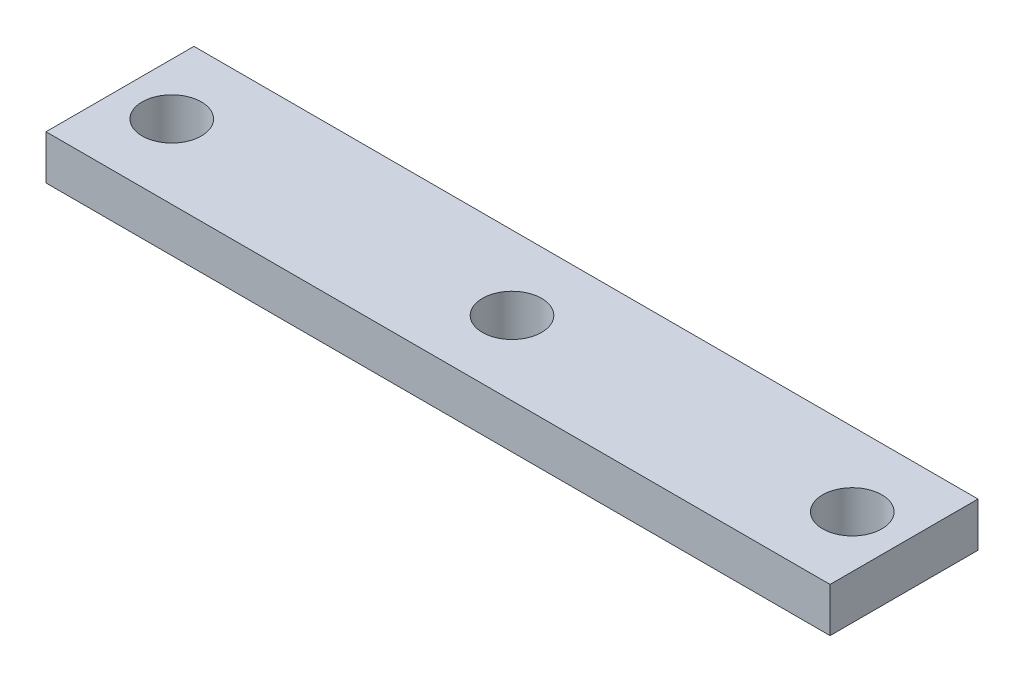
from build123d import *

# Parameters (mm, degrees)
SKETCH1_W           = 53
SKETCH1_H           = 10
SKETCH1_R           = 2
BOSS_EXTRUDE1_DEPTH = 3


with BuildPart() as part:
    # Sketch1 → Boss-Extrude1 (new body)
    with BuildSketch(Plane(origin=(0, 0, 0), x_dir=(1, 0, 0), z_dir=(0, 1, 0))):
        Rectangle(SKETCH1_W, SKETCH1_H)
        with Locations(Location((-23, 0, 0), (0, 0, 270))):
            Circle(SKETCH1_R, mode=Mode.SUBTRACT)
        with Locations(Location((23, 0, 0), (0, 0, 270))):
            Circle(SKETCH1_R, mode=Mode.SUBTRACT)
        with Locations(Location((0, 0, 0), (0, 0, 270))):
            Circle(SKETCH1_R, mode=Mode.SUBTRACT)
    extrude(amount=BOSS_EXTRUDE1_DEPTH)


solid = part.part
